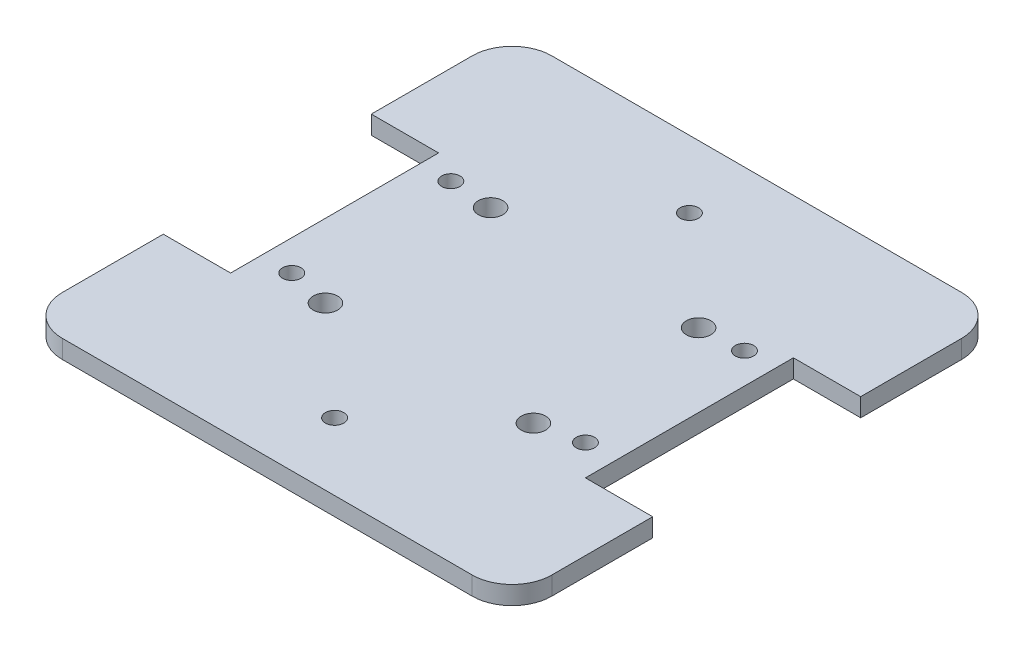
from build123d import *

# Parameters (mm, degrees)
SKETCH1_R           = 1.5
SKETCH1_R_2         = 2
BOSS_EXTRUDE1_DEPTH = 3


with BuildPart() as part:
    # Sketch1 → Boss-Extrude1 (new body)
    with BuildSketch(Plane(origin=(0, 0, 0), x_dir=(1, 0, 0), z_dir=(0, 1, 0))):
        with BuildLine():
            Line((6.5, 0), (73.5, 0))
            ThreePointArc((73.5, 0), (78.096194078, 1.903805922), (80, 6.5))
            Line((80, 6.5), (80, 23))
            Line((80, 23), (69, 23))
            Line((69, 23), (69, 57))
            Line((69, 57), (80, 57))
            Line((80, 57), (80, 73.5))
            ThreePointArc((80, 73.5), (78.096194078, 78.096194078), (73.5, 80))
            Line((73.5, 80), (6.5, 80))
            ThreePointArc((6.5, 80), (1.903805922, 78.096194078), (0, 73.5))
            Line((0, 73.5), (0, 57))
            Line((0, 57), (11, 57))
            Line((11, 57), (11, 23))
            Line((11, 23), (0, 23))
            Line((0, 23), (0, 6.5))
            ThreePointArc((0, 6.5), (1.903805922, 1.903805922), (6.5, 0))
        make_face()
        with Locations(Location((16, 54, 0), (0, 0, 270))):
            Circle(SKETCH1_R, mode=Mode.SUBTRACT)
        with Locations(Location((16, 28, 0), (0, 0, 270))):
            Circle(SKETCH1_R, mode=Mode.SUBTRACT)
        with Locations(Location((64, 28, 0), (0, 0, 90))):
            Circle(SKETCH1_R, mode=Mode.SUBTRACT)
        with Locations(Location((64, 54, 0), (0, 0, 90))):
            Circle(SKETCH1_R, mode=Mode.SUBTRACT)
        with Locations(Location((23, 53.5, 0), (0, 0, 270))):
            Circle(SKETCH1_R_2, mode=Mode.SUBTRACT)
        with Locations(Location((23, 26.5, 0), (0, 0, 270))):
            Circle(SKETCH1_R_2, mode=Mode.SUBTRACT)
        with Locations(Location((57, 26.5, 0), (0, 0, 90))):
            Circle(SKETCH1_R_2, mode=Mode.SUBTRACT)
        with Locations(Location((57, 53.5, 0), (0, 0, 90))):
            Circle(SKETCH1_R_2, mode=Mode.SUBTRACT)
        with Locations(Location((40, 69, 0), (0, 0, 270))):
            Circle(SKETCH1_R, mode=Mode.SUBTRACT)
        with Locations(Location((40, 11, 0), (0, 0, 90))):
            Circle(SKETCH1_R, mode=Mode.SUBTRACT)
    extrude(amount=BOSS_EXTRUDE1_DEPTH)


solid = part.part
